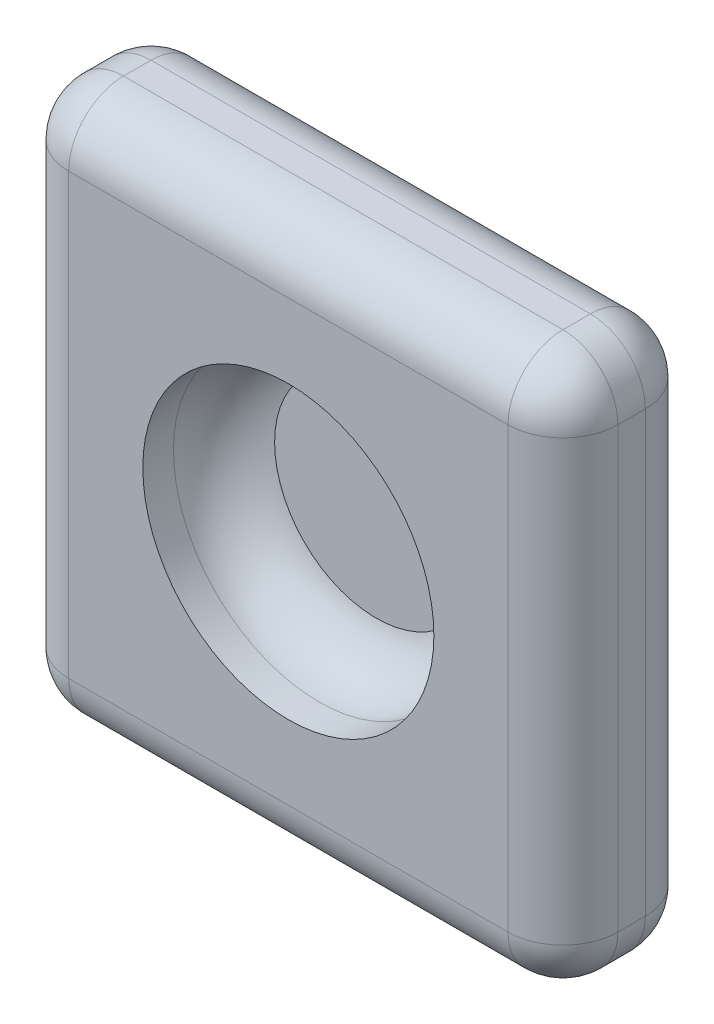
from build123d import *

# Parameters (mm, degrees)
SKETCH1_W           = 100
SKETCH1_H           = 100
BOSS_EXTRUDE1_DEPTH = 25
FILLET2_R           = 10
CUT_EXTRUDE1_START  = -2
SKETCH5_R           = 4
CUT_EXTRUDE1_DEPTH  = 3


with BuildPart() as part:
    # Sketch1 → Boss-Extrude1 (new body)
    with BuildSketch(Plane(origin=(0, 0, 0), x_dir=(0, 1, 0), z_dir=(0, 0, 1))):
        Rectangle(SKETCH1_W, SKETCH1_H)
    extrude(amount=BOSS_EXTRUDE1_DEPTH)

    # Sketch4 → Cut-Revolve2 (revolve, cut)
    with BuildSketch(Plane(origin=(0, 0, 0), x_dir=(0, -1, 0), z_dir=(-1, 0, 0))):
        with BuildLine():
            Line((0, 25), (0, 9))
            Line((0, 9), (-18.5, 9))
            ThreePointArc((-18.5, 9), (-24.269303538, 12.850991806), (-26.5, 19.41902001))
            Line((-26.5, 19.41902001), (-26.5, 25))
            Line((-26.5, 25), (0, 25))
        make_face()
    revolve(axis=Axis((0, 0, 0), (0, 0, 1)), mode=Mode.SUBTRACT)

    # Fillet2
    fillet2_edges = [part.edges().sort_by_distance(p)[0] for p in [
        (0, -50, 25),
        (0, -50, 0),
        (50, -50, 12.5),
        (50, 0, 25),
        (50, 0, 0),
        (-50, 0, 25),
        (-50, -50, 12.5),
        (-50, 0, 0),
        (50, 50, 12.5),
        (0, 50, 25),
        (-50, 50, 12.5),
        (0, 50, 0),
    ]]
    fillet(fillet2_edges, radius=FILLET2_R)

    # Sketch5 → Cut-Extrude1 (cut)
    with BuildSketch(Plane(origin=(0, 0, 0), x_dir=(1, 0, 0), z_dir=(0, 0, -1)).offset(CUT_EXTRUDE1_START)):
        Circle(SKETCH5_R)
    extrude(amount=-CUT_EXTRUDE1_DEPTH, mode=Mode.SUBTRACT)


solid = part.part
